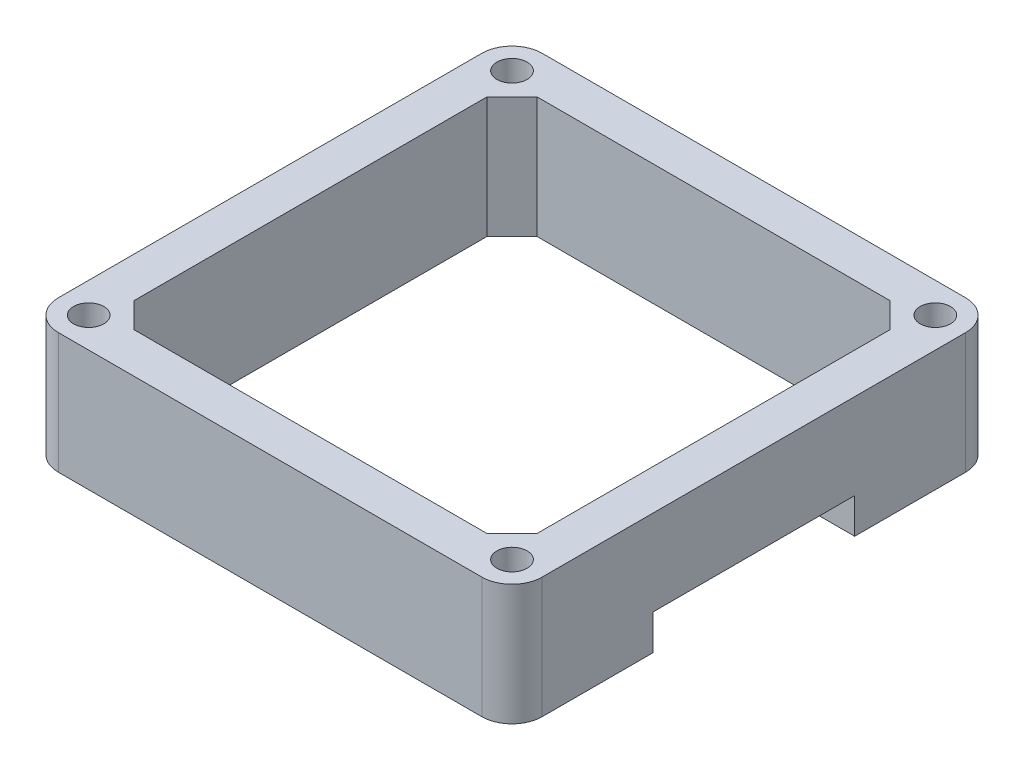
from build123d import *

# Parameters (mm, degrees)
SKETCH3_R           = 1.5
BOSS_EXTRUDE1_DEPTH = 12
SKETCH4_W           = 20
SKETCH4_H           = 3.5
CUT_EXTRUDE1_DEPTH  = 4


with BuildPart() as part:
    # Sketch3 → Boss-Extrude1 (new body)
    with BuildSketch(Plane(origin=(0, 0, 0), x_dir=(1, 0, 0), z_dir=(0, 1, 0))):
        with BuildLine():
            Line((3, 0), (45, 0))
            ThreePointArc((45, 0), (47.121320344, 0.878679656), (48, 3))
            Line((48, 3), (48, 45))
            ThreePointArc((48, 45), (47.121320344, 47.121320344), (45, 48))
            Line((45, 48), (3, 48))
            ThreePointArc((3, 48), (0.878679656, 47.121320344), (0, 45))
            Line((0, 45), (0, 3))
            ThreePointArc((0, 3), (0.878679656, 0.878679656), (3, 0))
        make_face()
        with Locations(Location((3, 45, 0), (0, 0, 270))):
            Circle(SKETCH3_R, mode=Mode.SUBTRACT)
        with Locations(Location((3, 3, 0), (0, 0, 90))):
            Circle(SKETCH3_R, mode=Mode.SUBTRACT)
        with Locations(Location((45, 3, 0), (0, 0, 270))):
            Circle(SKETCH3_R, mode=Mode.SUBTRACT)
        with Locations(Location((45, 45, 0), (0, 0, 90))):
            Circle(SKETCH3_R, mode=Mode.SUBTRACT)
        Polygon((4, 41.5), (6.5, 44), (41.5, 44), (44, 41.5), (44, 6.5), (41.5, 4), (6.5, 4), (4, 6.5), align=None, mode=Mode.SUBTRACT)
    extrude(amount=BOSS_EXTRUDE1_DEPTH)

    # Sketch4 → Cut-Extrude1 (cut)
    with BuildSketch(Plane(origin=(48, 0, 0), x_dir=(0, 0, -1), z_dir=(1, 0, 0))):
        with Locations((24, 1.75)):
            Rectangle(SKETCH4_W, SKETCH4_H)
    extrude(amount=-CUT_EXTRUDE1_DEPTH, mode=Mode.SUBTRACT)


solid = part.part
